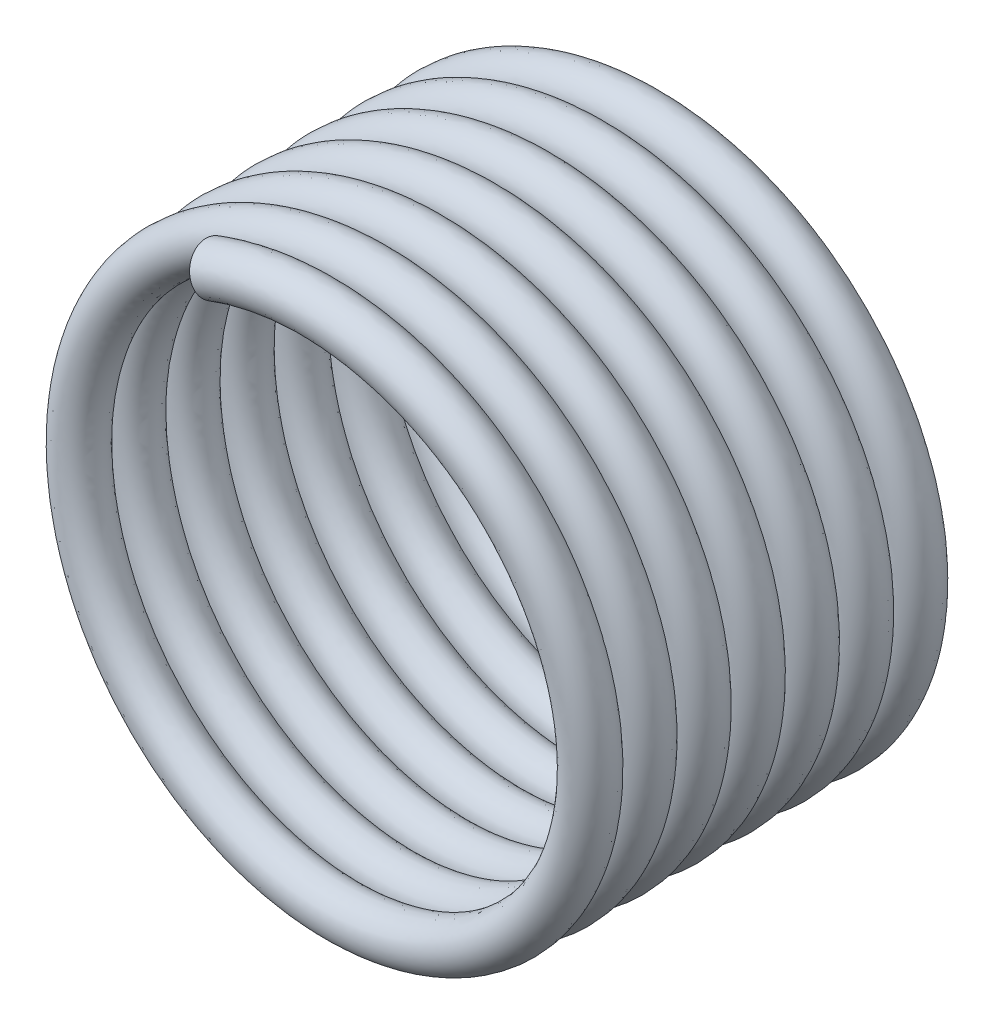
from build123d import *

# Parameters (mm, degrees)
SWEEP1_PITCH       = 1.123497428
SWEEP1_HEIGHT      = 7.6454
SWEEP1_RADIUS      = 5.3721
SWEEP1_START_ANGLE = -180
SKETCH2_R          = 0.4826


with BuildPart() as part:
    # Sweep1: sweep along a helix
    with BuildLine() as sweep1_path:
        add(Helix(SWEEP1_PITCH, SWEEP1_HEIGHT, SWEEP1_RADIUS, center=(0, 0, 0), direction=(0, 0, 1), mode=Mode.PRIVATE).rotate(Axis((0, 0, 0), (0, 0, 1)), SWEEP1_START_ANGLE))
    # Sketch2 → Sweep1 (sweep)
    with BuildSketch(Plane(origin=(-1.819733981, 5.054505579, 7.6454), x_dir=(0.037032287292150384, -0.004667898869401979, 0.999303167421207), z_dir=(-0.9403600058959775, -0.3385504340079141, 0.03326654391983416))):
        with Locations((0.001589314, 0.206647084)):
            Circle(SKETCH2_R)
    sweep(path=sweep1_path.line, is_frenet=True)


solid = part.part
